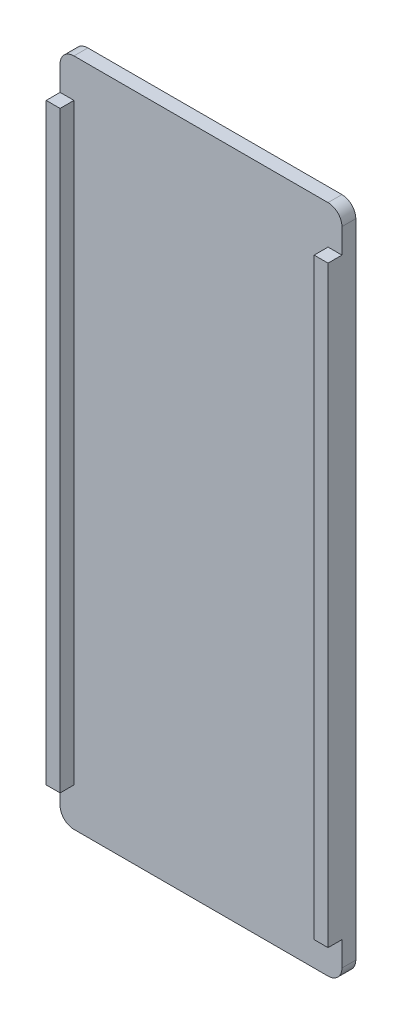
from build123d import *

# Parameters (mm, degrees)
Y_KSEKLIK_EKSTR_ZYON1_DEPTH = 2
IZIM2_W                     = 2
IZIM2_H                     = 85.4
Y_KSEKLIK_EKSTR_ZYON2_DEPTH = 2


with BuildPart() as part:
    # Çizim1 → Yükseklik-Ekstrüzyon1 (new body)
    with BuildSketch(Plane.XY):
        with BuildLine():
            Line((-18.3, -48.25), (18.3, -48.25))
            ThreePointArc((18.3, -48.25), (19.714213562, -47.664213562), (20.3, -46.25))
            Line((20.3, -46.25), (20.3, 46.25))
            ThreePointArc((20.3, 46.25), (19.714213562, 47.664213562), (18.3, 48.25))
            Line((18.3, 48.25), (-18.3, 48.25))
            ThreePointArc((-18.3, 48.25), (-19.714213562, 47.664213562), (-20.3, 46.25))
            Line((-20.3, 46.25), (-20.3, -46.25))
            ThreePointArc((-20.3, -46.25), (-19.714213562, -47.664213562), (-18.3, -48.25))
        make_face()
    extrude(amount=Y_KSEKLIK_EKSTR_ZYON1_DEPTH)

    # Çizim2 → Yükseklik-Ekstrüzyon2 (add)
    with BuildSketch(Plane.XY.offset(2)):
        with Locations((-19.3, 0)):
            Rectangle(IZIM2_W, IZIM2_H)
        with Locations((19.3, 0)):
            Rectangle(IZIM2_W, IZIM2_H)
    extrude(amount=Y_KSEKLIK_EKSTR_ZYON2_DEPTH)


solid = part.part
